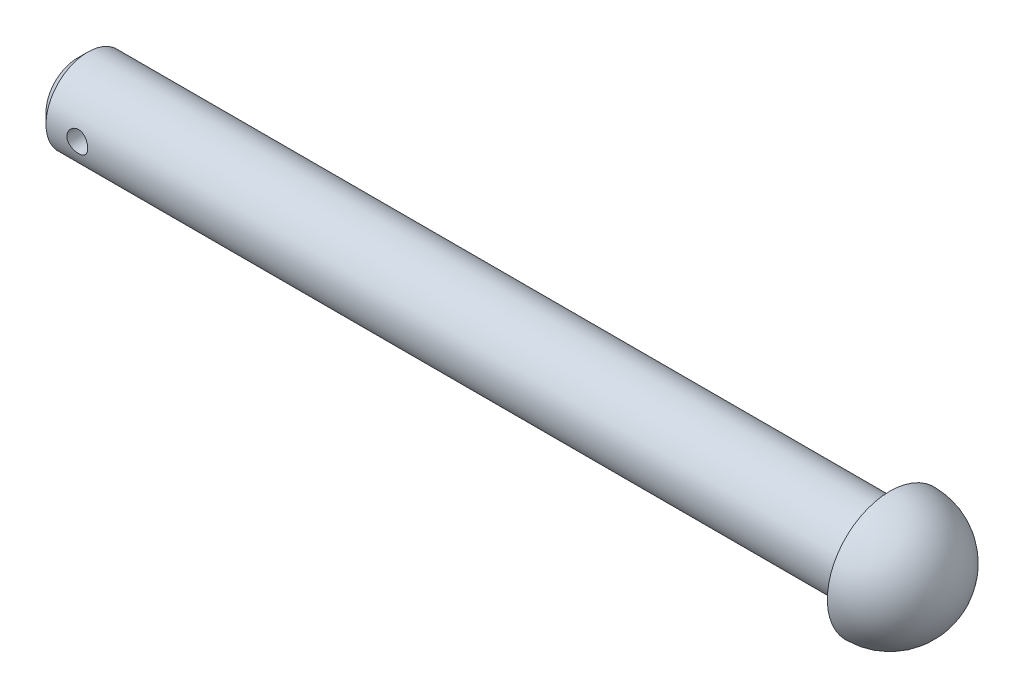
from build123d import *

# Parameters (mm, degrees)
SKETCH2_R          = 0.5
CUT_EXTRUDE1_DEPTH = 5
CHAMFER1_SIZE      = 0.5


with BuildPart() as part:
    # Sketch1 → Revolve1 (revolve)
    with BuildSketch(Plane.XY):
        with BuildLine():
            Line((0, 0), (0, 2))
            Line((0, 2), (39, 2))
            Line((39, 2), (39, 3))
            ThreePointArc((39, 3), (41.121320344, 2.121320344), (42, 0))
            Line((42, 0), (0, 0))
        make_face()
    revolve(axis=Axis((42, 0, 0), (-1, 0, 0)))

    # Sketch2 → Cut-Extrude1 (cut, symmetric)
    with BuildSketch(Plane.XY):
        with Locations((2, 0)):
            Circle(SKETCH2_R)
    extrude(amount=CUT_EXTRUDE1_DEPTH, both=True, mode=Mode.SUBTRACT)

    # Chamfer1
    chamfer1_edges = [part.edges().sort_by_distance(p)[0] for p in [
        (0, -2, 0),
    ]]
    chamfer(chamfer1_edges, length=CHAMFER1_SIZE)


solid = part.part
